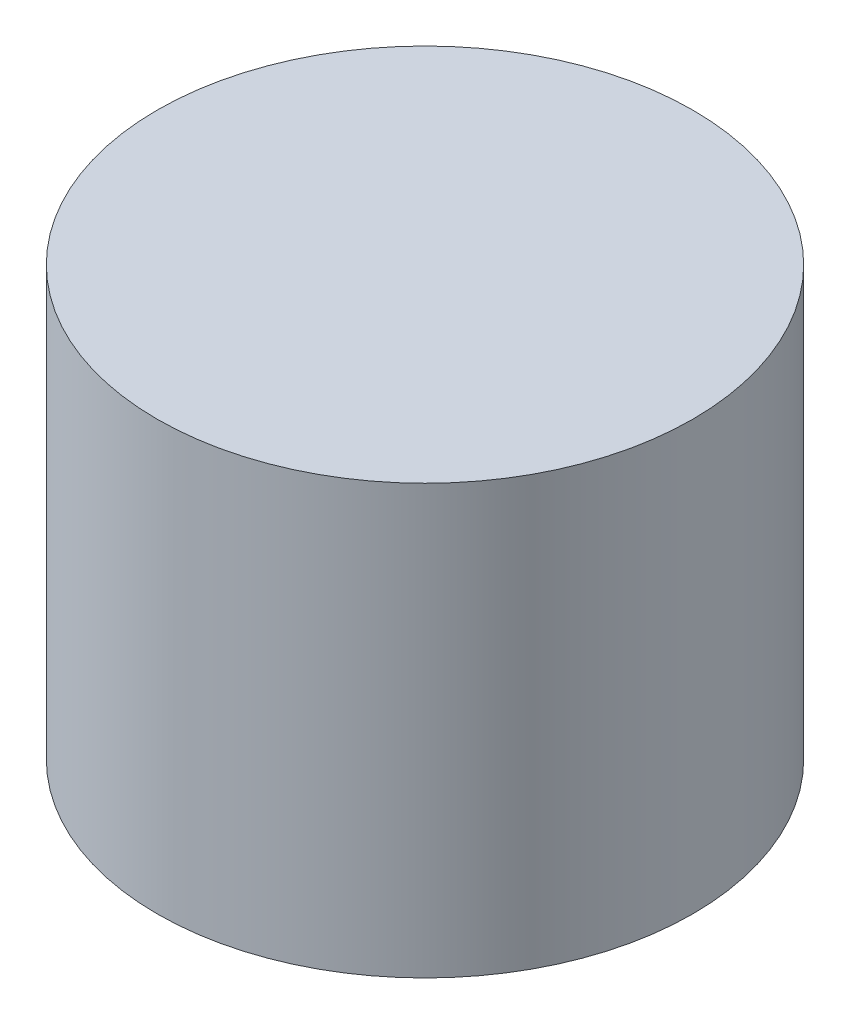
from build123d import *

# Parameters (mm, degrees)
SKETCH1_R           = 3.96875
BOSS_EXTRUDE1_DEPTH = 6.35


with BuildPart() as part:
    # Sketch1 → Boss-Extrude1 (new body)
    with BuildSketch(Plane(origin=(0, 0, 0), x_dir=(1, 0, 0), z_dir=(0, 1, 0))):
        with Locations(Location((0, 0, 0), (0, 0, 270))):
            Circle(SKETCH1_R)
    extrude(amount=BOSS_EXTRUDE1_DEPTH)


solid = part.part
